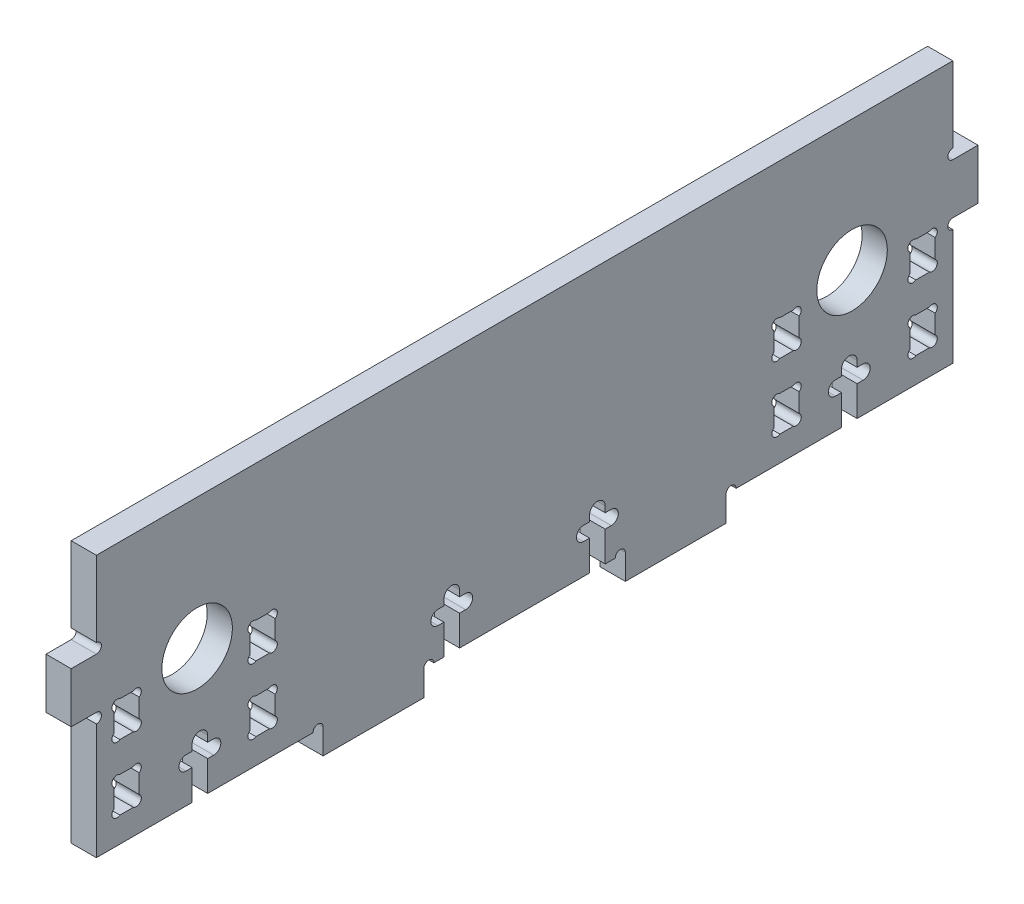
from build123d import *

# Parameters (mm, degrees)
SKETCH_1_W          = 170
SKETCH_1_H          = 52
EXTRUDE_1_DEPTH     = 5
SKETCH_2_R          = 7
CUT_EXTRUDE_1_DEPTH = 10
SKETCH_3_W          = 20
SKETCH_3_H          = 5
EXTRUDE_2_DEPTH     = 5
CUT_EXTRUDE_2_DEPTH = 10
SKETCH_8_W          = 5
SKETCH_8_H          = 10
EXTRUDE_3_DEPTH     = 5
SKETCH_7_R          = 1
CUT_EXTRUDE_3_DEPTH = 10
SKETCH_10_W         = 5
SKETCH_10_H         = 7
CUT_EXTRUDE_4_DEPTH = 10
SKETCH_11_R         = 1
CUT_EXTRUDE_5_DEPTH = 10


with BuildPart() as part:
    # 스케치1 → 보스-돌출1 (new body)
    with BuildSketch(Plane(origin=(0, 0, 0), x_dir=(0, 0, -1), z_dir=(1, 0, 0))):
        with Locations((85, 26)):
            Rectangle(SKETCH_1_W, SKETCH_1_H)
    extrude(amount=EXTRUDE_1_DEPTH)

    # 스케치2 → 컷-돌출1 (cut)
    with BuildSketch(Plane(origin=(5, 0, 0), x_dir=(0, 0, -1), z_dir=(1, 0, 0))):
        with Locations((150, 26)):
            Circle(SKETCH_2_R)
        with Locations((20, 26)):
            Circle(SKETCH_2_R)
    extrude(amount=-CUT_EXTRUDE_1_DEPTH, mode=Mode.SUBTRACT)

    # 스케치3 → 보스-돌출2 (add)
    with BuildSketch(Plane(origin=(5, 0, 0), x_dir=(0, 0, -1), z_dir=(1, 0, 0))):
        with Locations((55, -2.5)):
            Rectangle(SKETCH_3_W, SKETCH_3_H)
        with Locations((115, -2.5)):
            Rectangle(SKETCH_3_W, SKETCH_3_H)
    extrude(amount=-EXTRUDE_2_DEPTH)

    # 스케치6 → 컷-돌출2 (cut)
    with BuildSketch(Plane(origin=(5, 0, 0), x_dir=(0, 0, -1), z_dir=(1, 0, 0))):
        with BuildLine():
            Line((151, 0), (151, 6))
            Line((151, 6), (152.2, 6))
            ThreePointArc((152.2, 6), (153.6, 7.4), (152.2, 8.8))
            Line((152.2, 8.8), (151, 8.8))
            Line((151, 8.8), (151, 10))
            ThreePointArc((151, 10), (149.45, 11.55), (147.9, 10))
            Line((147.9, 10), (147.9, 8.8))
            Line((147.9, 8.8), (146.7, 8.8))
            ThreePointArc((146.7, 8.8), (145.3, 7.4), (146.7, 6))
            Line((146.7, 6), (147.9, 6))
            Line((147.9, 6), (147.9, 0))
            Line((147.9, 0), (151, 0))
        make_face()
        with BuildLine():
            Line((101, 0), (101, 6))
            Line((101, 6), (102.2, 6))
            ThreePointArc((102.2, 6), (103.6, 7.4), (102.2, 8.8))
            Line((102.2, 8.8), (101, 8.8))
            Line((101, 8.8), (101, 10))
            ThreePointArc((101, 10), (99.45, 11.55), (97.9, 10))
            Line((97.9, 10), (97.9, 8.8))
            Line((97.9, 8.8), (96.7, 8.8))
            ThreePointArc((96.7, 8.8), (95.3, 7.4), (96.7, 6))
            Line((96.7, 6), (97.9, 6))
            Line((97.9, 6), (97.9, 0))
            Line((97.9, 0), (101, 0))
        make_face()
        with BuildLine():
            Line((67.8, 6), (69, 6))
            Line((69, 6), (69, 0))
            Line((69, 0), (72.1, 0))
            Line((72.1, 0), (72.1, 6))
            Line((72.1, 6), (73.3, 6))
            ThreePointArc((73.3, 6), (74.7, 7.4), (73.3, 8.8))
            Line((73.3, 8.8), (72.1, 8.8))
            Line((72.1, 8.8), (72.1, 10))
            ThreePointArc((72.1, 10), (70.55, 11.55), (69, 10))
            Line((69, 10), (69, 8.8))
            Line((69, 8.8), (67.8, 8.8))
            ThreePointArc((67.8, 8.8), (66.4, 7.4), (67.8, 6))
        make_face()
        with BuildLine():
            Line((17.8, 6), (19, 6))
            Line((19, 6), (19, 0))
            Line((19, 0), (22.1, 0))
            Line((22.1, 0), (22.1, 6))
            Line((22.1, 6), (23.3, 6))
            ThreePointArc((23.3, 6), (24.7, 7.4), (23.3, 8.8))
            Line((23.3, 8.8), (22.1, 8.8))
            Line((22.1, 8.8), (22.1, 10))
            ThreePointArc((22.1, 10), (20.55, 11.55), (19, 10))
            Line((19, 10), (19, 8.8))
            Line((19, 8.8), (17.8, 8.8))
            ThreePointArc((17.8, 8.8), (16.4, 7.4), (17.8, 6))
        make_face()
    extrude(amount=-CUT_EXTRUDE_2_DEPTH, mode=Mode.SUBTRACT)

    # 스케치8 → 보스-돌출3 (add)
    with BuildSketch(Plane(origin=(5, 0, 0), x_dir=(0, 0, -1), z_dir=(1, 0, 0))):
        with Locations((172.5, 30)):
            Rectangle(SKETCH_8_W, SKETCH_8_H)
        with Locations((-2.5, 30)):
            Rectangle(SKETCH_8_W, SKETCH_8_H)
    extrude(amount=-EXTRUDE_3_DEPTH)

    # 스케치7 → 컷-돌출3 (cut)
    with BuildSketch(Plane(origin=(5, 0, 0), x_dir=(0, 0, -1), z_dir=(1, 0, 0))):
        with Locations((66, 0)):
            Circle(SKETCH_7_R)
        with Locations((44, 0)):
            Circle(SKETCH_7_R)
        with Locations((104, 0)):
            Circle(SKETCH_7_R)
        with Locations((126, 0)):
            Circle(SKETCH_7_R)
        with Locations((170, 36)):
            Circle(SKETCH_7_R)
        with Locations((170, 24)):
            Circle(SKETCH_7_R)
        with Locations((0, 36)):
            Circle(SKETCH_7_R)
        with Locations((0, 24)):
            Circle(SKETCH_7_R)
    extrude(amount=-CUT_EXTRUDE_3_DEPTH, mode=Mode.SUBTRACT)

    # 스케치10 → 컷-돌출4 (cut)
    with BuildSketch(Plane.ZY):
        with Locations((-164, 21.5)):
            Rectangle(SKETCH_10_W, SKETCH_10_H)
        with Locations((-137, 21.5)):
            Rectangle(SKETCH_10_W, SKETCH_10_H)
        with Locations((-164, 8.5)):
            Rectangle(SKETCH_10_W, SKETCH_10_H)
        with Locations((-137, 8.5)):
            Rectangle(SKETCH_10_W, SKETCH_10_H)
        with Locations((-33, 8.5)):
            Rectangle(SKETCH_10_W, SKETCH_10_H)
        with Locations((-6, 8.5)):
            Rectangle(SKETCH_10_W, SKETCH_10_H)
        with Locations((-33, 21.5)):
            Rectangle(SKETCH_10_W, SKETCH_10_H)
        with Locations((-6, 21.5)):
            Rectangle(SKETCH_10_W, SKETCH_10_H)
    extrude(amount=-CUT_EXTRUDE_4_DEPTH, mode=Mode.SUBTRACT)

    # 스케치11 → 컷-돌출5 (cut)
    with BuildSketch(Plane(origin=(5, 0, 0), x_dir=(0, 0, -1), z_dir=(1, 0, 0))):
        with Locations((165.918761806, 24.186266529)):
            Circle(SKETCH_11_R)
        with Locations((162.081238194, 24.186266529)):
            Circle(SKETCH_11_R)
        with Locations((165.918761806, 18.813733471)):
            Circle(SKETCH_11_R)
        with Locations((162.081238194, 18.813733471)):
            Circle(SKETCH_11_R)
        with Locations((138.918761806, 18.813733471)):
            Circle(SKETCH_11_R)
        with Locations((135.081238194, 18.813733471)):
            Circle(SKETCH_11_R)
        with Locations((138.918761806, 24.186266529)):
            Circle(SKETCH_11_R)
        with Locations((135.081238194, 24.186266529)):
            Circle(SKETCH_11_R)
        with Locations((135.081238194, 5.813733471)):
            Circle(SKETCH_11_R)
        with Locations((138.918761806, 5.813733471)):
            Circle(SKETCH_11_R)
        with Locations((135.081238194, 11.186266529)):
            Circle(SKETCH_11_R)
        with Locations((138.918761806, 11.186266529)):
            Circle(SKETCH_11_R)
        with Locations((162.081238194, 11.186266529)):
            Circle(SKETCH_11_R)
        with Locations((165.918761806, 11.186266529)):
            Circle(SKETCH_11_R)
        with Locations((162.081238194, 5.813733471)):
            Circle(SKETCH_11_R)
        with Locations((165.918761806, 5.813733471)):
            Circle(SKETCH_11_R)
        with Locations((4.081238194, 5.813733471)):
            Circle(SKETCH_11_R)
        with Locations((7.918761806, 5.813733471)):
            Circle(SKETCH_11_R)
        with Locations((4.081238194, 11.186266529)):
            Circle(SKETCH_11_R)
        with Locations((7.918761806, 11.186266529)):
            Circle(SKETCH_11_R)
        with Locations((31.081238194, 11.186266529)):
            Circle(SKETCH_11_R)
        with Locations((34.918761806, 11.186266529)):
            Circle(SKETCH_11_R)
        with Locations((31.081238194, 5.813733471)):
            Circle(SKETCH_11_R)
        with Locations((34.918761806, 5.813733471)):
            Circle(SKETCH_11_R)
        with Locations((34.918761806, 24.186266529)):
            Circle(SKETCH_11_R)
        with Locations((31.081238194, 24.186266529)):
            Circle(SKETCH_11_R)
        with Locations((34.918761806, 18.813733471)):
            Circle(SKETCH_11_R)
        with Locations((31.081238194, 18.813733471)):
            Circle(SKETCH_11_R)
        with Locations((7.918761806, 18.813733471)):
            Circle(SKETCH_11_R)
        with Locations((4.081238194, 18.813733471)):
            Circle(SKETCH_11_R)
        with Locations((7.918761806, 24.186266529)):
            Circle(SKETCH_11_R)
        with Locations((4.081238194, 24.186266529)):
            Circle(SKETCH_11_R)
    extrude(amount=-CUT_EXTRUDE_5_DEPTH, mode=Mode.SUBTRACT)


solid = part.part
